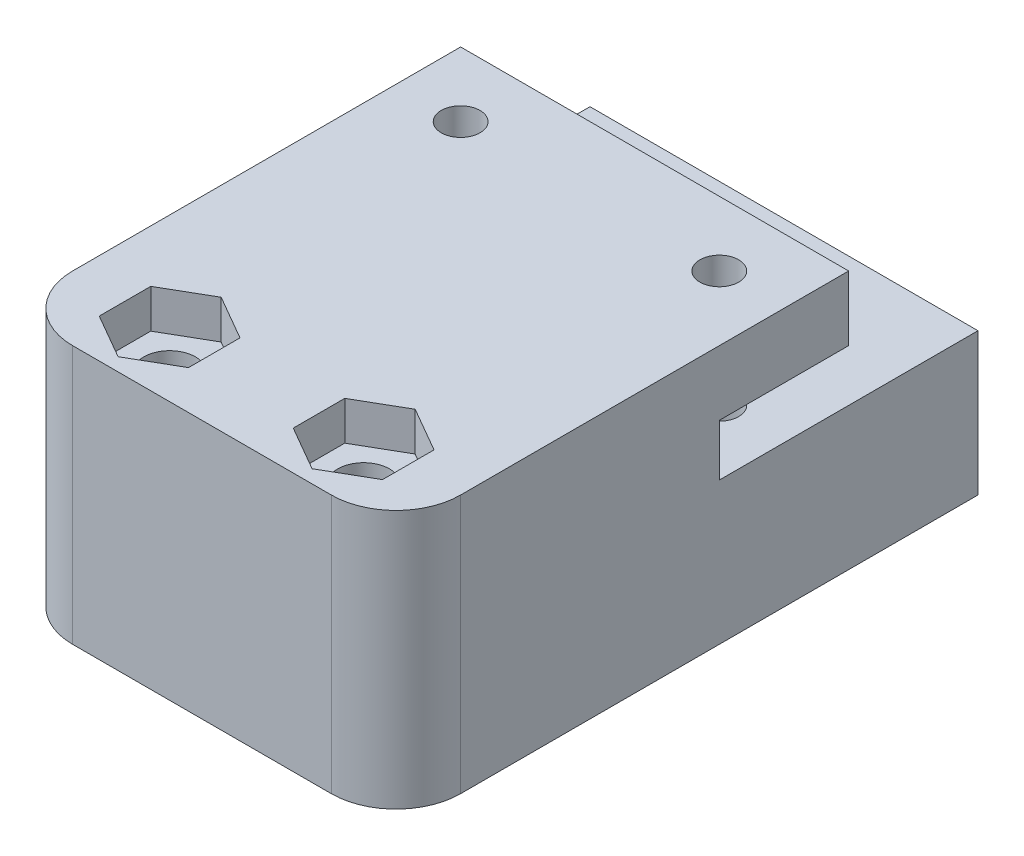
from build123d import *

# Parameters (mm, degrees)
CROQUIS1_W              = 30
CROQUIS1_H              = 35
CROQUIS1_R              = 1.5
CROQUIS1_R_2            = 2
SALIENTE_EXTRUIR1_DEPTH = 20
CROQUIS2_W              = 10
CROQUIS2_H              = 4
CORTAR_EXTRUIR1_DEPTH   = 41
CORTAR_EXTRUIR2_DEPTH   = 2
CORTAR_EXTRUIR3_DEPTH   = 3
CORTAR_EXTRUIR4_DEPTH   = 3
REDONDEO1_R             = 5
CROQUIS6_W              = 30
CROQUIS6_H              = 11
SALIENTE_EXTRUIR2_DEPTH = 10


with BuildPart() as part:
    # Croquis1 → Saliente-Extruir1 (new body)
    with BuildSketch(Plane(origin=(0, 0, 0), x_dir=(1, 0, 0), z_dir=(0, 1, 0))):
        with Locations((15, 17.5)):
            Rectangle(CROQUIS1_W, CROQUIS1_H)
        with Locations(Location((25, 30, 0), (0, 0, 270))):
            Circle(CROQUIS1_R, mode=Mode.SUBTRACT)
        with Locations(Location((5, 30, 0), (0, 0, 270))):
            Circle(CROQUIS1_R, mode=Mode.SUBTRACT)
        with Locations(Location((7.5, 5, 0), (0, 0, 270))):
            Circle(CROQUIS1_R_2, mode=Mode.SUBTRACT)
        with Locations(Location((22.5, 5, 0), (0, 0, 270))):
            Circle(CROQUIS1_R_2, mode=Mode.SUBTRACT)
    extrude(amount=SALIENTE_EXTRUIR1_DEPTH)

    # Croquis2 → Cortar-Extruir1 (cut)
    with BuildSketch(Plane(origin=(30, 0, 0), x_dir=(0, 0, -1), z_dir=(1, 0, 0))):
        with Locations((30, 13)):
            Rectangle(CROQUIS2_W, CROQUIS2_H)
    extrude(amount=-CORTAR_EXTRUIR1_DEPTH, mode=Mode.SUBTRACT)

    # Croquis3 → Cortar-Extruir2 (cut)
    with BuildSketch(Plane.XZ):
        Polygon((5, -33.117691454), (7.7, -31.558845727), (7.7, -28.441154273), (5, -26.882308546), (2.3, -28.441154273), (2.3, -31.558845727), align=None)
        Polygon((25, -33.117691454), (27.7, -31.558845727), (27.7, -28.441154273), (25, -26.882308546), (22.3, -28.441154273), (22.3, -31.558845727), align=None)
    extrude(amount=-CORTAR_EXTRUIR2_DEPTH, mode=Mode.SUBTRACT)

    # Croquis4 → Cortar-Extruir3 (cut)
    with BuildSketch(Plane.XZ):
        Polygon((7.5, -8.983716857), (10.95, -6.991858429), (10.95, -3.008141571), (7.5, -1.016283143), (4.05, -3.008141571), (4.05, -6.991858429), align=None)
        Polygon((22.5, -8.983716857), (25.95, -6.991858429), (25.95, -3.008141571), (22.5, -1.016283143), (19.05, -3.008141571), (19.05, -6.991858429), align=None)
    extrude(amount=-CORTAR_EXTRUIR3_DEPTH, mode=Mode.SUBTRACT)

    # Croquis5 → Cortar-Extruir4 (cut)
    with BuildSketch(Plane(origin=(0, 20, 0), x_dir=(1, 0, 0), z_dir=(0, 1, 0))):
        Polygon((22.5, 1.016283143), (19.05, 3.008141571), (19.05, 6.991858429), (22.5, 8.983716857), (25.95, 6.991858429), (25.95, 3.008141571), align=None)
        Polygon((4.05, 6.991858429), (7.5, 8.983716857), (10.95, 6.991858429), (10.95, 3.008141571), (7.5, 1.016283143), (4.05, 3.008141571), align=None)
    extrude(amount=-CORTAR_EXTRUIR4_DEPTH, mode=Mode.SUBTRACT)

    # Redondeo1
    redondeo1_edges = [part.edges().sort_by_distance(p)[0] for p in [
        (30, 10, 0),
        (0, 10, 0),
    ]]
    fillet(redondeo1_edges, radius=REDONDEO1_R)

    # Croquis6 → Saliente-Extruir2 (add)
    with BuildSketch(Plane(origin=(0, 0, -35), x_dir=(-1, 0, 0), z_dir=(0, 0, -1))):
        with Locations((-15, 5.5)):
            Rectangle(CROQUIS6_W, CROQUIS6_H)
    extrude(amount=SALIENTE_EXTRUIR2_DEPTH)


solid = part.part
